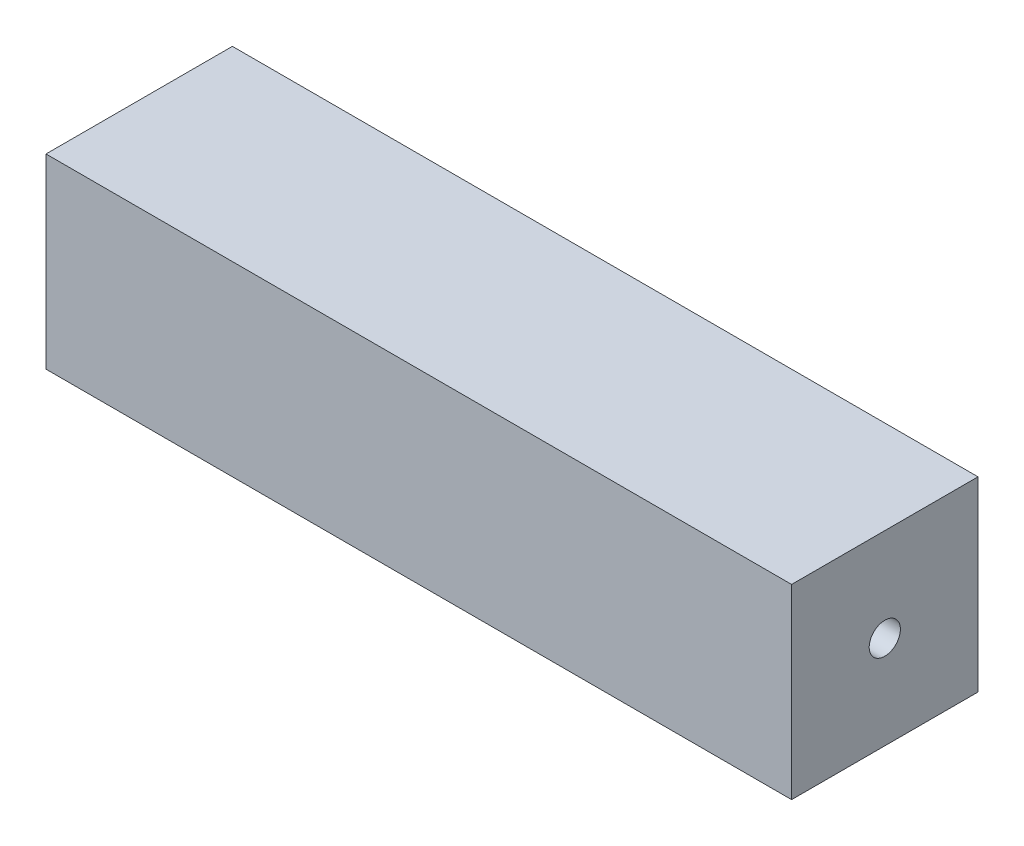
from build123d import *

# Parameters (mm, degrees)
SKETCH1_W           = 80
SKETCH1_H           = 20
BOSS_EXTRUDE1_DEPTH = 20
SKETCH2_R           = 1.672668985
CUT_EXTRUDE1_DEPTH  = 20


with BuildPart() as part:
    # Sketch1 → Boss-Extrude1 (new body)
    with BuildSketch(Plane(origin=(0, 0, 0), x_dir=(1, 0, 0), z_dir=(0, 1, 0))):
        with Locations((40, 10)):
            Rectangle(SKETCH1_W, SKETCH1_H)
    extrude(amount=BOSS_EXTRUDE1_DEPTH)

    # Sketch2 → Cut-Extrude1 (cut)
    with BuildSketch(Plane(origin=(80, 0, 0), x_dir=(0, 0, -1), z_dir=(1, 0, 0))):
        with Locations((10, 10)):
            Circle(SKETCH2_R)
    extrude(amount=-CUT_EXTRUDE1_DEPTH, mode=Mode.SUBTRACT)


solid = part.part
